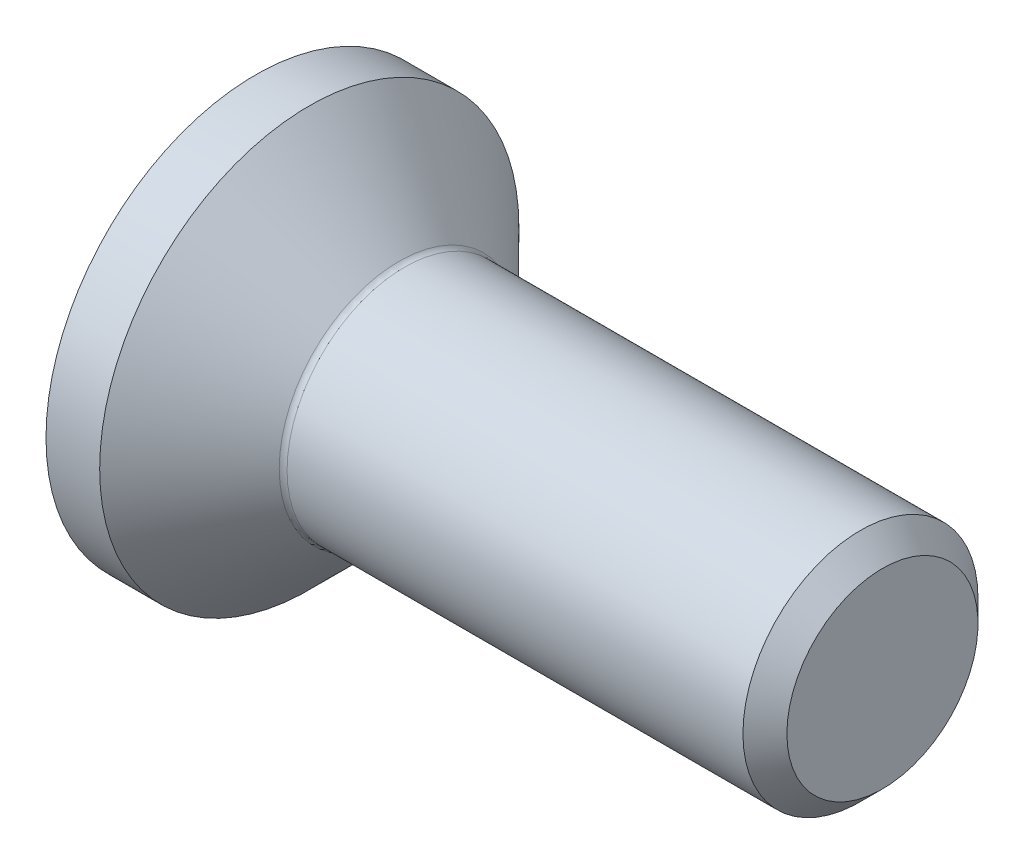
from build123d import *

# Parameters (mm, degrees)
FILLET1_R   = 0.1
HEX_2_DEPTH = 1.1


with BuildPart() as part:
    # BodySke → BaseBody (revolve)
    with BuildSketch(Plane.XY, mode=Mode.PRIVATE) as basebody_sk:
        Polygon((0, 0), (0, 2.675), (0.685, 2.675), (1.86, 1.5), (7.7195, 1.5), (8, 1.2195), (8, 0), align=None)
    revolve(basebody_sk.sketch.rotate(Axis((0, 0, 0), (1, 0, 0)), 90), axis=Axis((0, 0, 0), (1, 0, 0)))

    # Fillet1
    fillet1_edges = [part.edges().sort_by_distance(p)[0] for p in [
        (1.86, 0, -1.5),
    ]]
    fillet(fillet1_edges, radius=FILLET1_R)

    # Sketch2 → PreBroach (revolve, cut)
    with BuildSketch(Plane.XY, mode=Mode.PRIVATE) as prebroach_sk:
        Polygon((0, 1), (1.1, 1), (1.677350269, 0), (0, 0), align=None)
    revolve(prebroach_sk.sketch.rotate(Axis((0, 0, 0), (1, 0, 0)), 90), axis=Axis((0, 0, 0), (1, 0, 0)), mode=Mode.SUBTRACT)

    # Sketch3 → Hex 2 (cut)
    with BuildSketch(Plane.ZY):
        Polygon((-1, -0.577350269), (-1, 0.577350269), (0, 1.154700538), (1, 0.577350269), (1, -0.577350269), (0, -1.154700538), align=None)
    extrude(amount=-HEX_2_DEPTH, mode=Mode.SUBTRACT)


solid = part.part
